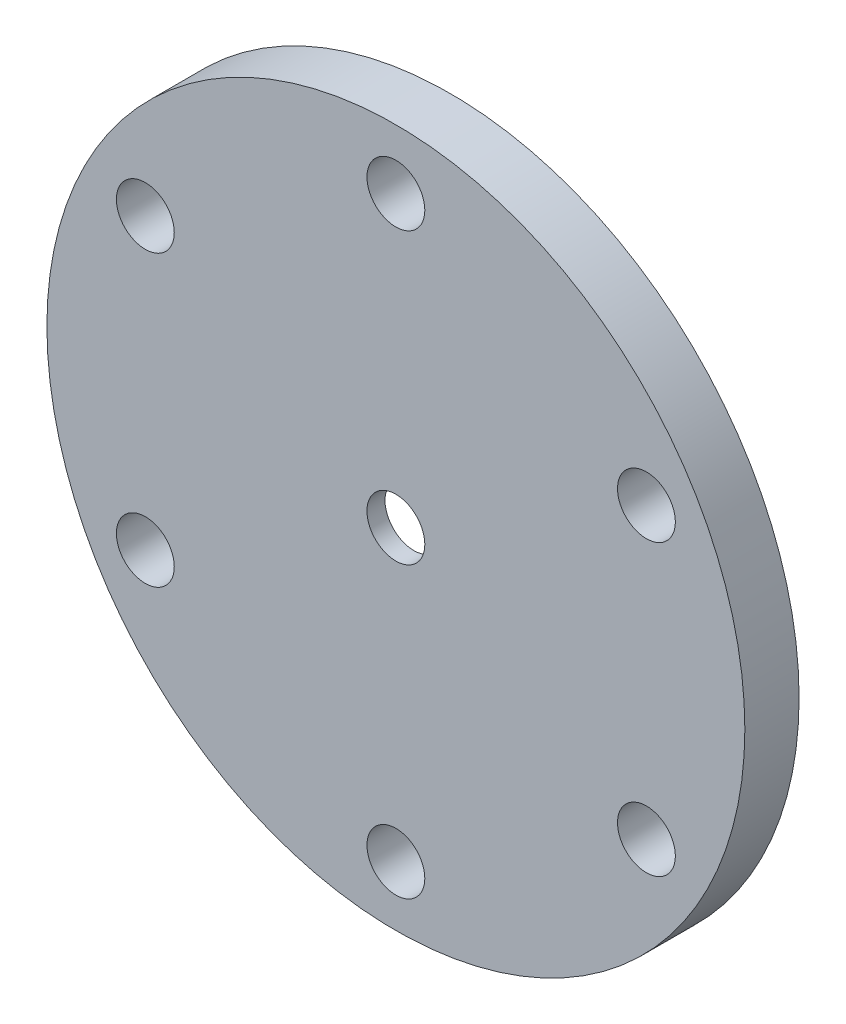
from build123d import *

# Parameters (mm, degrees)
CROQUIS1_R              = 19.3
CROQUIS1_R_2            = 1.6
SALIENTE_EXTRUIR1_DEPTH = 1.5
CROQUIS2_R              = 12
CROQUIS2_R_2            = 1.6
CORTAR_EXTRUIR1_DEPTH   = 2


with BuildPart() as part:
    # Croquis1 → Saliente-Extruir1 (new, symmetric)
    with BuildSketch(Plane.XY):
        Circle(CROQUIS1_R)
        with Locations((0, 16)):
            Circle(CROQUIS1_R_2, mode=Mode.SUBTRACT)
        Circle(CROQUIS1_R_2, mode=Mode.SUBTRACT)
        with Locations((13.856406461, 8)):
            Circle(CROQUIS1_R_2, mode=Mode.SUBTRACT)
        with Locations((13.856406461, -8)):
            Circle(CROQUIS1_R_2, mode=Mode.SUBTRACT)
        with Locations((0, -16)):
            Circle(CROQUIS1_R_2, mode=Mode.SUBTRACT)
        with Locations((-13.856406461, -8)):
            Circle(CROQUIS1_R_2, mode=Mode.SUBTRACT)
        with Locations((-13.856406461, 8)):
            Circle(CROQUIS1_R_2, mode=Mode.SUBTRACT)
    extrude(amount=SALIENTE_EXTRUIR1_DEPTH, both=True)

    # Croquis2 → Cortar-Extruir1 (cut)
    with BuildSketch(Plane(origin=(0, 0, -1.5), x_dir=(-1, 0, 0), z_dir=(0, 0, -1))):
        Circle(CROQUIS2_R)
        Circle(CROQUIS2_R_2, mode=Mode.SUBTRACT)
    extrude(amount=-CORTAR_EXTRUIR1_DEPTH, mode=Mode.SUBTRACT)


solid = part.part
